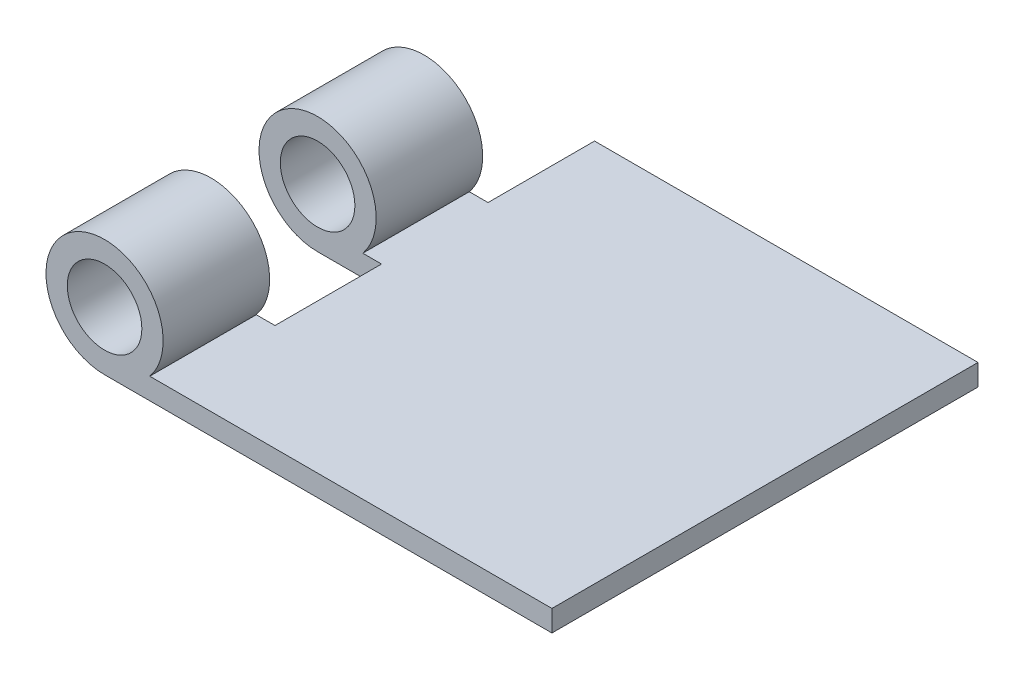
from build123d import *

# Parameters (mm, degrees)
BOSS_EXTRUDE1_DEPTH = 1
SKETCH2_R           = 2.75
SKETCH2_R_2         = 1.75
BOSS_EXTRUDE2_DEPTH = 5
BOSS_EXTRUDE3_START = -5
SKETCH3_R           = 2.75
SKETCH3_R_2         = 1.75
BOSS_EXTRUDE3_DEPTH = 5


with BuildPart() as part:
    # Sketch1 → Boss-Extrude1 (new body)
    with BuildSketch(Plane(origin=(0, 0, 0), x_dir=(1, 0, 0), z_dir=(0, 1, 0))):
        Polygon((18, 10), (18, 5), (15, 5), (15, 0), (18, 0), (18, -5), (15, -5), (15, -10), (36, -10), (36, 10), align=None)
    extrude(amount=-BOSS_EXTRUDE1_DEPTH)

    # Sketch2 → Boss-Extrude2 (add)
    with BuildSketch(Plane.XY.offset(10)):
        with Locations((15, 1.75)):
            Circle(SKETCH2_R)
        with Locations((15, 1.75)):
            Circle(SKETCH2_R_2, mode=Mode.SUBTRACT)
    extrude(amount=-BOSS_EXTRUDE2_DEPTH)

    # Sketch3 → Boss-Extrude3 (add)
    with BuildSketch(Plane(origin=(0, 0, -5), x_dir=(-1, 0, 0), z_dir=(0, 0, -1)).offset(BOSS_EXTRUDE3_START)):
        with Locations((-15, 1.75)):
            Circle(SKETCH3_R)
        with Locations(Location((-15, 1.75, 0), (0, 0, 180))):
            Circle(SKETCH3_R_2, mode=Mode.SUBTRACT)
    extrude(amount=BOSS_EXTRUDE3_DEPTH)


solid = part.part
